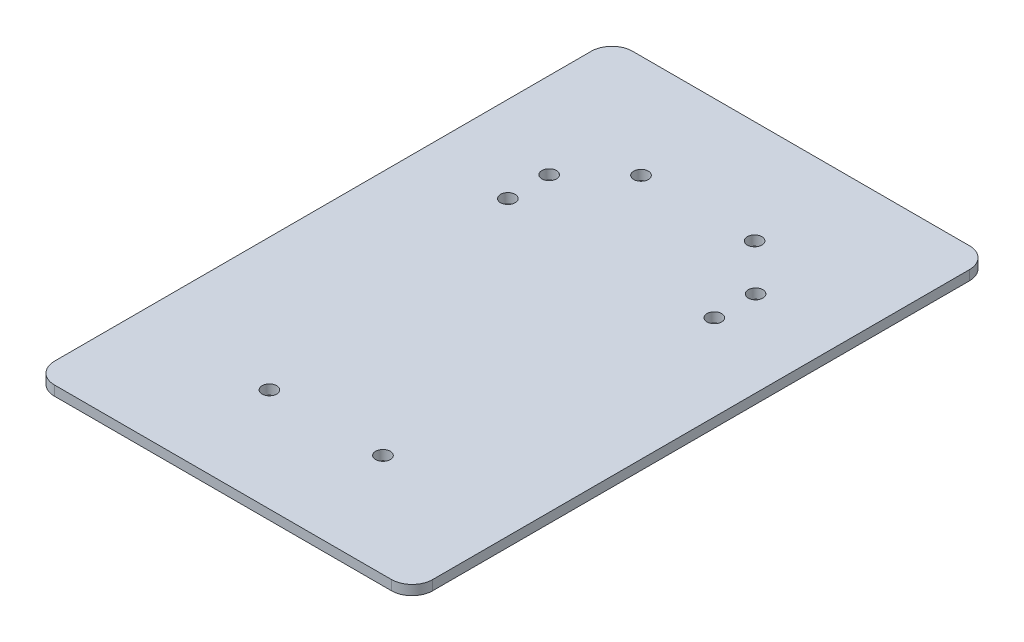
from build123d import *

# Parameters (mm, degrees)
SKETCH1_W               = 116.332
SKETCH1_H               = 177.8
BOSS_EXTRUDE1_DEPTH     = 3
CUT_EXTRUDE1_DEPTH      = 213.496998153
CUT_EXTRUDE1_DEPTH_BACK = 213.496998153
SKETCH3_R               = 2.25
CUT_EXTRUDE2_DEPTH      = 213.496998153
CUT_EXTRUDE2_DEPTH_BACK = 213.496998153
SKETCH4_R               = 2.25
FILLET1_R               = 6.35


with BuildPart() as part:
    # Sketch1 → Boss-Extrude1 (new body)
    with BuildSketch(Plane(origin=(0, 0, 0), x_dir=(1, 0, 0), z_dir=(0, 1, 0))):
        with Locations((58.166, -88.9)):
            Rectangle(SKETCH1_W, SKETCH1_H)
    extrude(amount=BOSS_EXTRUDE1_DEPTH)

    # Sketch3 → Cut-Extrude1 (cut, two sides: drawn at the far end of the back side and taken through both)
    with BuildSketch(Plane(origin=(0, 3, 0), x_dir=(1, 0, 0), z_dir=(0, 1, 0)).offset(-CUT_EXTRUDE1_DEPTH_BACK)):
        with Locations(Location((26.416, -45.72, 0), (0, 0, 270))):
            Circle(SKETCH3_R)
        with Locations(Location((26.416, -58.42, 0), (0, 0, 270))):
            Circle(SKETCH3_R)
        with Locations(Location((89.916, -45.72, 0), (0, 0, 270))):
            Circle(SKETCH3_R)
        with Locations(Location((89.916, -58.42, 0), (0, 0, 270))):
            Circle(SKETCH3_R)
    extrude(amount=CUT_EXTRUDE1_DEPTH + CUT_EXTRUDE1_DEPTH_BACK, mode=Mode.SUBTRACT)

    # Sketch4 → Cut-Extrude2 (cut, two sides: drawn at the far end of the back side and taken through both)
    with BuildSketch(Plane(origin=(0, 3, 0), x_dir=(1, 0, 0), z_dir=(0, 1, 0)).offset(-CUT_EXTRUDE2_DEPTH_BACK)):
        with Locations(Location((40.7035, -31.75, 0), (0, 0, 270))):
            Circle(SKETCH4_R)
        with Locations(Location((75.6285, -31.75, 0), (0, 0, 270))):
            Circle(SKETCH4_R)
        with Locations(Location((40.7035, -146.05, 0), (0, 0, 270))):
            Circle(SKETCH4_R)
        with Locations(Location((75.6285, -146.05, 0), (0, 0, 270))):
            Circle(SKETCH4_R)
    extrude(amount=CUT_EXTRUDE2_DEPTH + CUT_EXTRUDE2_DEPTH_BACK, mode=Mode.SUBTRACT)

    # Fillet1
    fillet1_edges = [part.edges().sort_by_distance(p)[0] for p in [
        (116.332, 1.5, 0),
        (116.332, 1.5, 177.8),
        (0, 1.5, 177.8),
        (0, 1.5, 0),
    ]]
    fillet(fillet1_edges, radius=FILLET1_R)


solid = part.part
